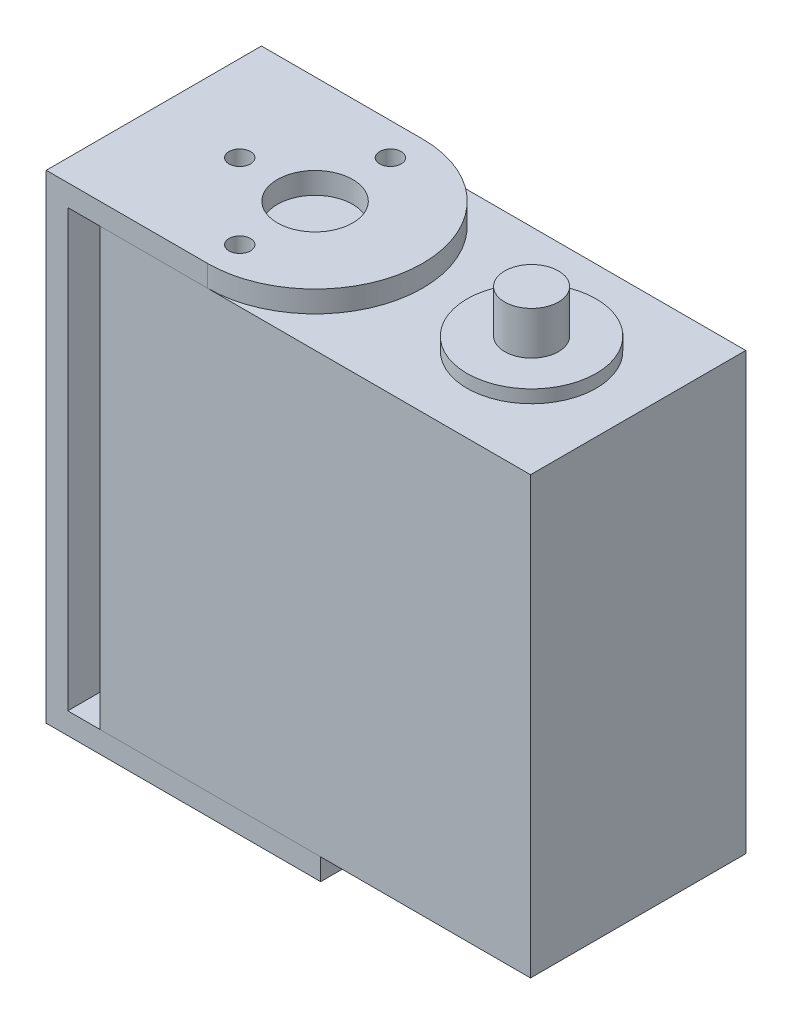
from build123d import *

# Parameters (mm, degrees)
SKETCH_1_W          = 40
SKETCH_1_H          = 40.5
EXTRUDE_1_DEPTH     = 20
SKETCH_2_R          = 6
EXTRUDE_2_DEPTH     = 2
SKETCH_4_R          = 2.5
EXTRUDE_3_DEPTH     = 2.5
EXTRUDE_START       = 2.5
SKETCH_5_R          = 2.5
EXTRUDE_4_DEPTH     = 2.5
SKETCH_6_R          = 1
CUT_EXTRUDE_1_DEPTH = 2.5
SKETCH_7_R          = 1
CUT_EXTRUDE_2_DEPTH = 2.5
SKETCH_8_R          = 6
SKETCH_8_R_2        = 2.5
CUT_EXTRUDE_3_DEPTH = 0.5
EXTRUDE_START_2     = 1
SKETCH_9_R          = 2.5
EXTRUDE_5_DEPTH     = 1
CUT_EXTRUDE_START   = -0.8
SKETCH_10_R         = 6
SKETCH_10_R_2       = 2.5
CUT_EXTRUDE_4_DEPTH = 0.8
SKETCH_11_R         = 2.5
EXTRUDE_6_DEPTH     = 0.7
SKETCH_13_R         = 0.5
CUT_EXTRUDE_5_DEPTH = 1
SKETCH_14_R         = 3
EXTRUDE_7_DEPTH     = 4
SKETCH_15_W         = 27
SKETCH_15_H         = 20
SKETCH_15_R         = 1
SKETCH_15_R_2       = 3.5
EXTRUDE_8_DEPTH     = 2
SKETCH_16_R         = 3.5
SKETCH_16_R_2       = 1
EXTRUDE_9_DEPTH     = 2
SKETCH_18_W         = 20
SKETCH_18_H         = 2
CUT_EXTRUDE_6_DEPTH = 3
SKETCH_19_W         = 20
SKETCH_19_H         = 2
EXTRUDE_10_DEPTH    = 1.5
SKETCH_20_W         = 20
SKETCH_20_H         = 2
EXTRUDE_11_DEPTH    = 1.5
SKETCH_21_W         = 2
SKETCH_21_H         = 20
EXTRUDE_12_DEPTH    = 40.5
CUT_EXTRUDE_7_DEPTH = 2
SKETCH_23_R         = 2.5
CUT_EXTRUDE_8_DEPTH = 2


with BuildPart() as part:
    # 草图1 → 凸台-拉伸1 (new body)
    with BuildSketch(Plane.XY):
        with Locations((20, 20.25)):
            Rectangle(SKETCH_1_W, SKETCH_1_H)
    extrude(amount=EXTRUDE_1_DEPTH)

    # 草图2 → 凸台-拉伸2 (add)
    with BuildSketch(Plane(origin=(0, 40.5, 0), x_dir=(1, 0, 0), z_dir=(0, 1, 0))):
        with Locations(Location((30.1, -10, 0), (0, 0, 90))):
            Circle(SKETCH_2_R)
    extrude_2 = extrude(amount=EXTRUDE_2_DEPTH)

    # 镜向1: 凸台-拉伸2 across plane
    add(extrude_2.mirror(Plane.ZX.offset(20.25)))

    # 草图4 → 凸台-拉伸3 (add)
    with BuildSketch(Plane(origin=(0, 42.5, 0), x_dir=(1, 0, 0), z_dir=(0, 1, 0))):
        with Locations(Location((30.1, -10, 0), (0, 0, 270))):
            Circle(SKETCH_4_R)
    extrude(amount=EXTRUDE_3_DEPTH)

    # 草图5 → 凸台-拉伸4 (add)
    with BuildSketch(Plane.XZ.offset(2).offset(EXTRUDE_START)):
        with Locations(Location((30.1, 10, 0), (0, 0, 90))):
            Circle(SKETCH_5_R)
    extrude(amount=-EXTRUDE_4_DEPTH)

    # 草图6 → 切除-拉伸1 (cut)
    with BuildSketch(Plane(origin=(0, 40.5, 0), x_dir=(1, 0, 0), z_dir=(0, 1, 0))):
        with Locations(Location((9.98, -3, 0), (0, 0, 270))):
            Circle(SKETCH_6_R)
        with Locations(Location((9.98, -17, 0), (0, 0, 270))):
            Circle(SKETCH_6_R)
        with Locations(Location((2.98, -10, 0), (0, 0, 270))):
            Circle(SKETCH_6_R)
    extrude(amount=-CUT_EXTRUDE_1_DEPTH, mode=Mode.SUBTRACT)

    # 草图7 → 切除-拉伸2 (cut)
    with BuildSketch(Plane.XZ):
        with Locations(Location((2.5, 17.5, 0), (0, 0, 270))):
            Circle(SKETCH_7_R)
        with Locations(Location((17.5, 17.5, 0), (0, 0, 270))):
            Circle(SKETCH_7_R)
        with Locations(Location((17.5, 2.5, 0), (0, 0, 270))):
            Circle(SKETCH_7_R)
        with Locations(Location((2.5, 2.5, 0), (0, 0, 270))):
            Circle(SKETCH_7_R)
    extrude(amount=-CUT_EXTRUDE_2_DEPTH, mode=Mode.SUBTRACT)

    # 草图8 → 切除-拉伸3 (cut)
    with BuildSketch(Plane.XZ.offset(2)):
        with Locations(Location((30.1, 10, 0), (0, 0, 90))):
            Circle(SKETCH_8_R)
        with Locations(Location((30.1, 10, 0), (0, 0, 90))):
            Circle(SKETCH_8_R_2, mode=Mode.SUBTRACT)
    extrude(amount=-CUT_EXTRUDE_3_DEPTH, mode=Mode.SUBTRACT)

    # 草图9 → 凸台-拉伸5 (add)
    with BuildSketch(Plane.XZ.offset(4.5).offset(EXTRUDE_START_2)):
        with Locations(Location((30.1, 10, 0), (0, 0, 90))):
            Circle(SKETCH_9_R)
    extrude(amount=-EXTRUDE_5_DEPTH)

    # 草图10 → 切除-拉伸4 (cut)
    with BuildSketch(Plane(origin=(0, 42.5, 0), x_dir=(1, 0, 0), z_dir=(0, 1, 0)).offset(CUT_EXTRUDE_START)):
        with Locations(Location((30.1, -10, 0), (0, 0, 90))):
            Circle(SKETCH_10_R)
        with Locations(Location((30.1, -10, 0), (0, 0, 90))):
            Circle(SKETCH_10_R_2, mode=Mode.SUBTRACT)
    extrude(amount=CUT_EXTRUDE_4_DEPTH, mode=Mode.SUBTRACT)

    # 草图11 → 凸台-拉伸6 (add)
    with BuildSketch(Plane(origin=(0, 45, 0), x_dir=(1, 0, 0), z_dir=(0, 1, 0))):
        with Locations(Location((30.1, -10, 0), (0, 0, 90))):
            Circle(SKETCH_11_R)
    extrude(amount=EXTRUDE_6_DEPTH)

    # 草图13 → 切除-拉伸5 (cut)
    with BuildSketch(Plane.XZ):
        with Locations(Location((10, 10, 0), (0, 0, 270))):
            Circle(SKETCH_13_R)
    extrude(amount=-CUT_EXTRUDE_5_DEPTH, mode=Mode.SUBTRACT)

    # 草图14 → 凸台-拉伸7 (add)
    with BuildSketch(Plane.XZ.offset(5.5)):
        with Locations(Location((30.1, 10, 0), (0, 0, 270))):
            Circle(SKETCH_14_R)
    extrude(amount=-EXTRUDE_7_DEPTH)


with BuildPart() as body_2:
    # 草图15 → 凸台-拉伸8 (new body)
    with BuildSketch(Plane.XZ):
        with Locations((10, 10)):
            Rectangle(SKETCH_15_W, SKETCH_15_H)
        with Locations(Location((2.5, 2.5, 0), (0, 0, 270))):
            Circle(SKETCH_15_R, mode=Mode.SUBTRACT)
        with Locations(Location((17.5, 2.5, 0), (0, 0, 270))):
            Circle(SKETCH_15_R, mode=Mode.SUBTRACT)
        with Locations(Location((17.5, 17.5, 0), (0, 0, 270))):
            Circle(SKETCH_15_R, mode=Mode.SUBTRACT)
        with Locations(Location((2.5, 17.5, 0), (0, 0, 270))):
            Circle(SKETCH_15_R, mode=Mode.SUBTRACT)
        with Locations(Location((10, 10, 0), (0, 0, 270))):
            Circle(SKETCH_15_R_2, mode=Mode.SUBTRACT)
    extrude(amount=EXTRUDE_8_DEPTH)

    # 草图18 → 切除-拉伸6 (cut)
    with BuildSketch(Plane(origin=(23.5, 0, 0), x_dir=(0, 0, -1), z_dir=(1, 0, 0))):
        with Locations((-10, -1)):
            Rectangle(SKETCH_18_W, SKETCH_18_H)
    extrude(amount=-CUT_EXTRUDE_6_DEPTH, mode=Mode.SUBTRACT)

    # 草图19 → 凸台-拉伸10 (add)
    with BuildSketch(Plane.ZY.offset(3.5)):
        with Locations((10, -1)):
            Rectangle(SKETCH_19_W, SKETCH_19_H)
    extrude(amount=EXTRUDE_10_DEPTH)



with BuildPart() as body_3:
    # 草图16 → 凸台-拉伸9 (new body)
    with BuildSketch(Plane(origin=(0, 40.5, 0), x_dir=(1, 0, 0), z_dir=(0, 1, 0))):
        with BuildLine():
            Line((-3.5, 0), (-3.5, -20))
            Line((-3.5, -20), (9.98, -20))
            ThreePointArc((9.98, -20), (19.98, -10), (9.98, 0))
            Line((9.98, 0), (-3.5, 0))
        make_face()
        with Locations(Location((9.98, -10, 0), (0, 0, 270))):
            Circle(SKETCH_16_R, mode=Mode.SUBTRACT)
        with Locations(Location((9.98, -17, 0), (0, 0, 270))):
            Circle(SKETCH_16_R_2, mode=Mode.SUBTRACT)
        with Locations(Location((9.98, -3, 0), (0, 0, 270))):
            Circle(SKETCH_16_R_2, mode=Mode.SUBTRACT)
        with Locations(Location((2.98, -10, 0), (0, 0, 270))):
            Circle(SKETCH_16_R_2, mode=Mode.SUBTRACT)
    extrude(amount=EXTRUDE_9_DEPTH)

    # 草图20 → 凸台-拉伸11 (add)
    with BuildSketch(Plane.ZY.offset(3.5)):
        with Locations((10, 41.5)):
            Rectangle(SKETCH_20_W, SKETCH_20_H)
    extrude(amount=EXTRUDE_11_DEPTH)


with BuildPart() as body_2_1:
    add(body_2.part)

    add(body_3.part)  # 凸台-拉伸12 merges body 3
    # 草图21 → 凸台-拉伸12 (add)
    with BuildSketch(Plane(origin=(0, 0, 0), x_dir=(1, 0, 0), z_dir=(0, 1, 0))):
        with Locations((-4, -10)):
            Rectangle(SKETCH_21_W, SKETCH_21_H)
    extrude(amount=EXTRUDE_12_DEPTH)

    # 草图22 → 切除-拉伸7 (cut)
    with BuildSketch(Plane.ZY.offset(5)):
        with BuildLine():
            ThreePointArc((7.6, 33.5), (5.466116524, 34.383883476), (6.35, 32.25))
            Line((6.35, 32.25), (6.35, 33.5))
            Line((6.35, 33.5), (7.6, 33.5))
        make_face()
        with BuildLine():
            Line((6.35, 33.5), (6.35, 32.25))
            ThreePointArc((6.35, 32.25), (7.233883476, 32.616116524), (7.6, 33.5))
            Line((7.6, 33.5), (6.35, 33.5))
        make_face()
        with BuildLine():
            ThreePointArc((12.4, 33.5), (12.766116524, 32.616116524), (13.65, 32.25))
            Line((13.65, 32.25), (13.65, 33.5))
            Line((13.65, 33.5), (12.4, 33.5))
        make_face()
        with BuildLine():
            Line((13.65, 33.5), (13.65, 32.25))
            ThreePointArc((13.65, 32.25), (14.533883476, 32.616116524), (14.9, 33.5))
            ThreePointArc((14.9, 33.5), (13.65, 34.75), (12.4, 33.5))
            Line((12.4, 33.5), (13.65, 33.5))
        make_face()
        with BuildLine():
            ThreePointArc((13.65, 8.25), (12.766116524, 7.883883476), (12.4, 7))
            Line((12.4, 7), (13.65, 7))
            Line((13.65, 7), (13.65, 8.25))
        make_face()
        with BuildLine():
            Line((13.65, 7), (12.4, 7))
            ThreePointArc((12.4, 7), (13.65, 5.75), (14.9, 7))
            ThreePointArc((14.9, 7), (14.533883476, 7.883883476), (13.65, 8.25))
            Line((13.65, 8.25), (13.65, 7))
        make_face()
        with BuildLine():
            Line((6.35, 8.25), (6.35, 7))
            Line((6.35, 7), (7.6, 7))
            ThreePointArc((7.6, 7), (7.233883476, 7.883883476), (6.35, 8.25))
        make_face()
        with BuildLine():
            Line((7.6, 7), (6.35, 7))
            Line((6.35, 7), (6.35, 8.25))
            ThreePointArc((6.35, 8.25), (5.466116524, 6.116116524), (7.6, 7))
        make_face()
    extrude(amount=-CUT_EXTRUDE_7_DEPTH, mode=Mode.SUBTRACT)

    # 草图23 → 切除-拉伸8 (cut)
    with BuildSketch(Plane.ZY.offset(5)):
        with Locations((10, 20.25)):
            Circle(SKETCH_23_R)
    extrude(amount=-CUT_EXTRUDE_8_DEPTH, mode=Mode.SUBTRACT)


solid = Compound([part.part, body_2_1.part])
